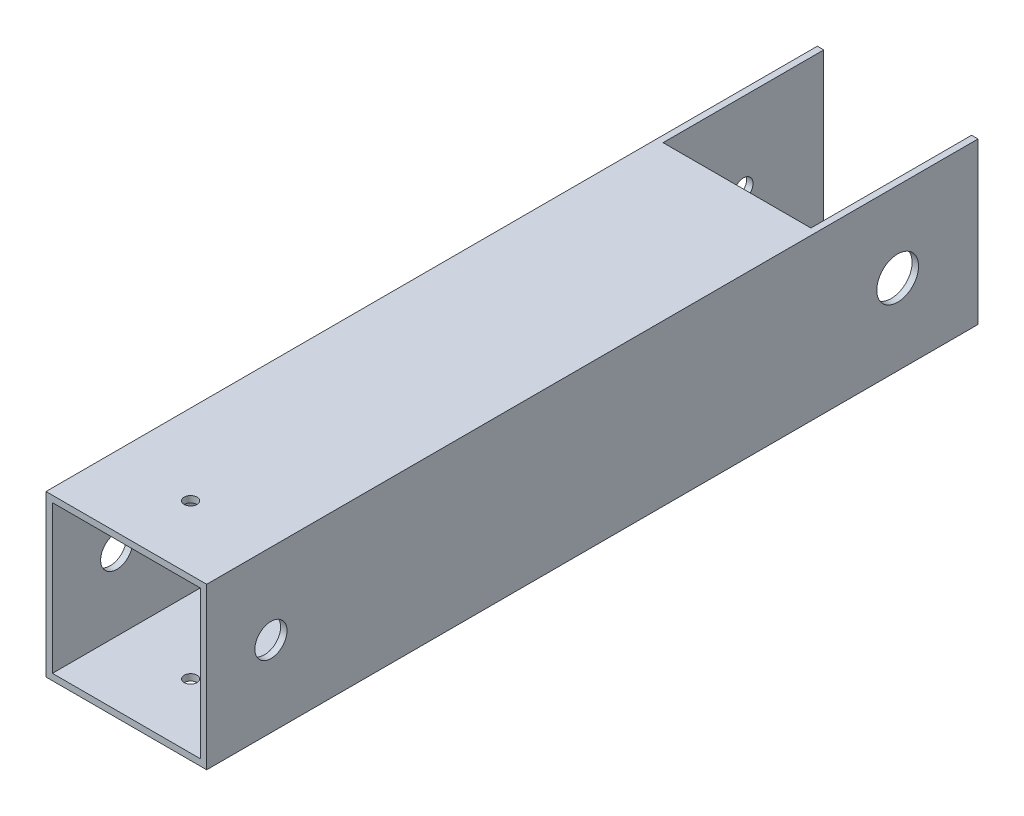
from build123d import *

# Parameters (mm, degrees)
SKETCH1_W           = 50
SKETCH1_H           = 50
SKETCH1_W_2         = 46
SKETCH1_H_2         = 46
BOSS_EXTRUDE1_DEPTH = 240
SKETCH2_W           = 46
SKETCH2_H           = 50
CUT_EXTRUDE1_DEPTH  = 247.424430607
CUT_EXTRUDE2_REACH  = 248.424
SKETCH3_R           = 6.5
SKETCH3_R_2         = 5
CUT_EXTRUDE3_REACH  = 248.424
SKETCH4_R           = 3
SKETCH4_R_2         = 5
SKETCH5_W           = 120
SKETCH5_H           = 46
CUT_EXTRUDE5_DEPTH  = 48
SKETCH6_R           = 2
CUT_EXTRUDE6_DEPTH  = 247.424430607


with BuildPart() as part:
    # Sketch1 → Boss-Extrude1 (new body)
    with BuildSketch(Plane.XY):
        Rectangle(SKETCH1_W, SKETCH1_H)
        Rectangle(SKETCH1_W_2, SKETCH1_H_2, mode=Mode.SUBTRACT)
    extrude(amount=-BOSS_EXTRUDE1_DEPTH)

    # Sketch2 → Cut-Extrude1 (cut, through all)
    with BuildSketch(Plane(origin=(0, 25, 0), x_dir=(1, 0, 0), z_dir=(0, 1, 0))):
        with Locations((0, 215)):
            Rectangle(SKETCH2_W, SKETCH2_H)
    extrude(amount=-CUT_EXTRUDE1_DEPTH, mode=Mode.SUBTRACT)

    # Sketch3 → Cut-Extrude2 (cut, up to next)
    with BuildSketch(Plane(origin=(25, 0, 0), x_dir=(0, 0, -1), z_dir=(1, 0, 0)), mode=Mode.PRIVATE) as cut_extrude2_sk1:
        with Locations((215, 0)):
            Circle(SKETCH3_R)
    cut_extrude2_tool1 = extrude(cut_extrude2_sk1.sketch, amount=-CUT_EXTRUDE2_REACH, mode=Mode.PRIVATE) & part.part
    # Sketch3 → Cut-Extrude2 (cut, up to next)
    with BuildSketch(Plane(origin=(25, 0, 0), x_dir=(0, 0, -1), z_dir=(1, 0, 0)), mode=Mode.PRIVATE) as cut_extrude2_sk2:
        with Locations((20, 0)):
            Circle(SKETCH3_R_2)
    cut_extrude2_tool2 = extrude(cut_extrude2_sk2.sketch, amount=-CUT_EXTRUDE2_REACH, mode=Mode.PRIVATE) & part.part
    add(cut_extrude2_tool1.solids().sort_by_distance((25, 0, -215))[0], mode=Mode.SUBTRACT)
    add(cut_extrude2_tool2.solids().sort_by_distance((25, 0, -20))[0], mode=Mode.SUBTRACT)

    # Sketch4 → Cut-Extrude3 (cut, up to next)
    with BuildSketch(Plane.ZY.offset(25), mode=Mode.PRIVATE) as cut_extrude3_sk1:
        with Locations((-215, 0)):
            Circle(SKETCH4_R)
    cut_extrude3_tool1 = extrude(cut_extrude3_sk1.sketch, amount=-CUT_EXTRUDE3_REACH, mode=Mode.PRIVATE) & part.part
    # Sketch4 → Cut-Extrude3 (cut, up to next)
    with BuildSketch(Plane.ZY.offset(25), mode=Mode.PRIVATE) as cut_extrude3_sk2:
        with Locations(Location((-20, 0, 0), (0, 0, 180))):
            Circle(SKETCH4_R_2)
    cut_extrude3_tool2 = extrude(cut_extrude3_sk2.sketch, amount=-CUT_EXTRUDE3_REACH, mode=Mode.PRIVATE) & part.part
    add(cut_extrude3_tool1.solids().sort_by_distance((-25, 0, -215))[0], mode=Mode.SUBTRACT)
    add(cut_extrude3_tool2.solids().sort_by_distance((-25, 0, -20))[0], mode=Mode.SUBTRACT)

    # Sketch5 → Cut-Extrude5 (cut)
    with BuildSketch(Plane(origin=(-25, 0, 0), x_dir=(0, 0, -1), z_dir=(1, 0, 0))):
        with Locations((115, 0)):
            Rectangle(SKETCH5_W, SKETCH5_H)
    extrude(amount=CUT_EXTRUDE5_DEPTH, mode=Mode.SUBTRACT)

    # Sketch6 → Cut-Extrude6 (cut, through all)
    with BuildSketch(Plane(origin=(0, 25, 0), x_dir=(1, 0, 0), z_dir=(0, 1, 0))):
        with Locations(Location((0, 20, 0), (0, 0, 270))):
            Circle(SKETCH6_R)
    extrude(amount=-CUT_EXTRUDE6_DEPTH, mode=Mode.SUBTRACT)


solid = part.part
